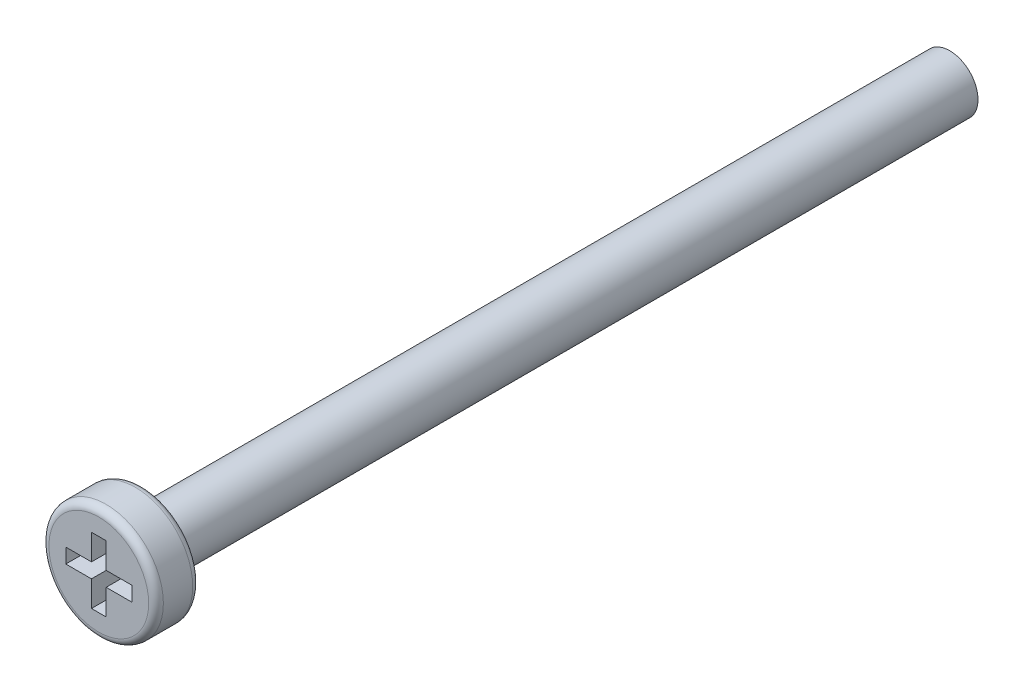
from build123d import *

# Parameters (mm, degrees)
ESBO_O5_R                = 3.9
RESSALTO_EXTRUS_O2_DEPTH = 3
CORTE_EXTRUS_O3_DEPTH    = 2
FILETE1_R                = 0.5
ESBO_O8_R                = 1.925
RESSALTO_EXTRUS_O3_DEPTH = 55


with BuildPart() as part:
    # Esboço5 → Ressalto-extrusão2 (new body)
    with BuildSketch(Plane.XY):
        Circle(ESBO_O5_R)
    extrude(amount=RESSALTO_EXTRUS_O2_DEPTH)

    # Esboço7 → Corte-extrusão3 (cut)
    with BuildSketch(Plane.XY.offset(3)):
        Polygon((-0.5, -0.5), (-2.25, -0.5), (-2.25, 0.5), (-0.5, 0.5), (-0.5, 2.25), (0.5, 2.25), (0.5, 0.5), (2.25, 0.5), (2.25, -0.5), (0.5, -0.5), (0.5, -2.25), (-0.5, -2.25), align=None)
    extrude(amount=-CORTE_EXTRUS_O3_DEPTH, mode=Mode.SUBTRACT)

    # Filete1
    filete1_edges = [part.edges().sort_by_distance(p)[0] for p in [
        (-3.9, 0, 0),
        (-3.9, 0, 3),
    ]]
    fillet(filete1_edges, radius=FILETE1_R)

    # Esboço8 → Ressalto-extrusão3 (add)
    with BuildSketch(Plane(origin=(0, 0, 0), x_dir=(-1, 0, 0), z_dir=(0, 0, -1))):
        with Locations(Location((0, 0, 0), (0, 0, 180))):
            Circle(ESBO_O8_R)
    extrude(amount=RESSALTO_EXTRUS_O3_DEPTH)


solid = part.part
